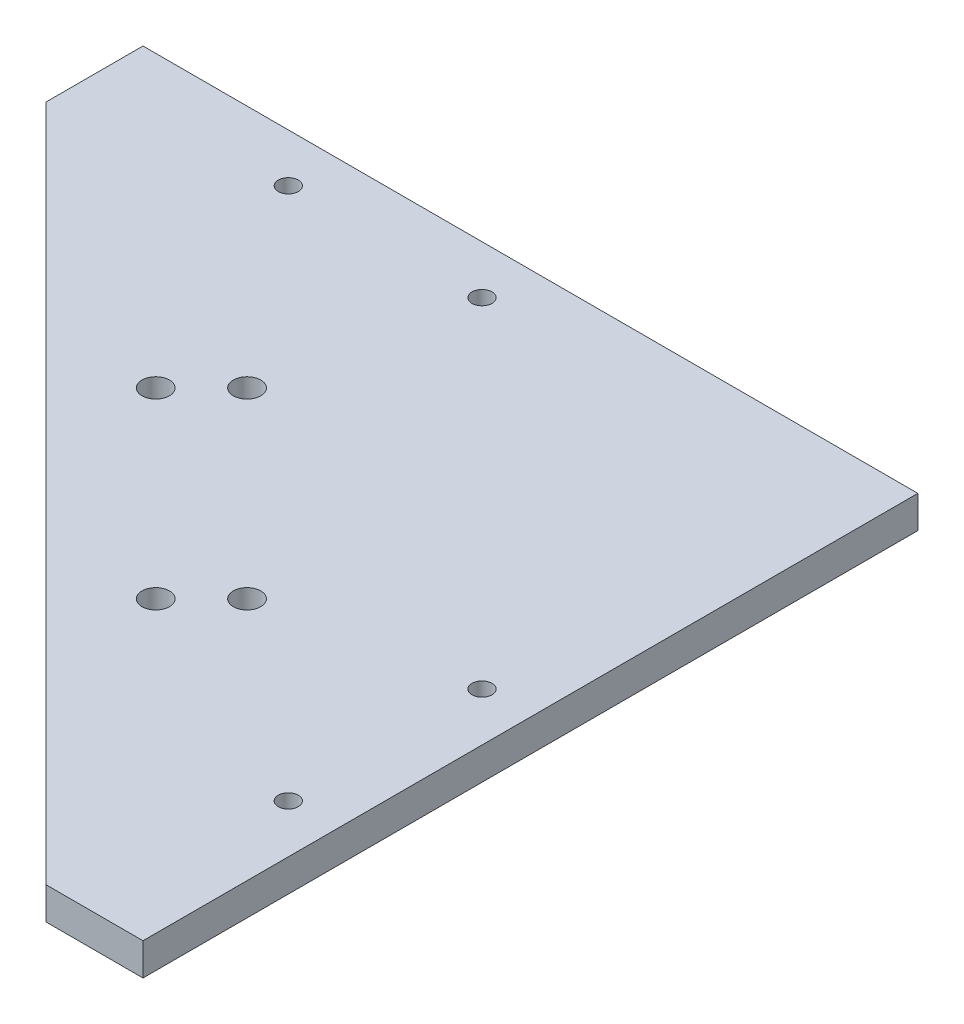
from build123d import *

# Parameters (mm, degrees)
BOSS_EXTRUDE1_DEPTH = 5
SKETCH3_R           = 1.55
CUT_EXTRUDE1_DEPTH  = 5
SKETCH4_R           = 2.125
CUT_EXTRUDE2_DEPTH  = 5


with BuildPart() as part:
    # Sketch2 → Boss-Extrude1 (new body)
    with BuildSketch(Plane(origin=(0, 0, 0), x_dir=(1, 0, 0), z_dir=(0, 1, 0))):
        Polygon((-120, -15), (-15, -120), (0, -120), (0, 0), (-120, 0), align=None)
    extrude(amount=BOSS_EXTRUDE1_DEPTH)

    # Sketch3 → Cut-Extrude1 (cut)
    with BuildSketch(Plane(origin=(0, 5, 0), x_dir=(1, 0, 0), z_dir=(0, 1, 0))):
        with Locations(Location((-90, -7.5, 0), (0, 0, 270))):
            Circle(SKETCH3_R)
        with Locations(Location((-60, -7.5, 0), (0, 0, 270))):
            Circle(SKETCH3_R)
        with Locations(Location((-7.5, -90, 0), (0, 0, 270))):
            Circle(SKETCH3_R)
        with Locations(Location((-7.5, -60, 0), (0, 0, 270))):
            Circle(SKETCH3_R)
    extrude(amount=-CUT_EXTRUDE1_DEPTH, mode=Mode.SUBTRACT)

    # Sketch4 → Cut-Extrude2 (cut)
    with BuildSketch(Plane(origin=(0, 5, 0), x_dir=(1, 0, 0), z_dir=(0, 1, 0))):
        with Locations(Location((-66.085786438, -37.80151519, 0), (0, 0, 270))):
            Circle(SKETCH4_R)
        with Locations(Location((-73.156854249, -44.872583002, 0), (0, 0, 270))):
            Circle(SKETCH4_R)
        with Locations(Location((-44.872583002, -73.156854249, 0), (0, 0, 90))):
            Circle(SKETCH4_R)
        with Locations(Location((-37.80151519, -66.085786438, 0), (0, 0, 90))):
            Circle(SKETCH4_R)
    extrude(amount=-CUT_EXTRUDE2_DEPTH, mode=Mode.SUBTRACT)


solid = part.part
